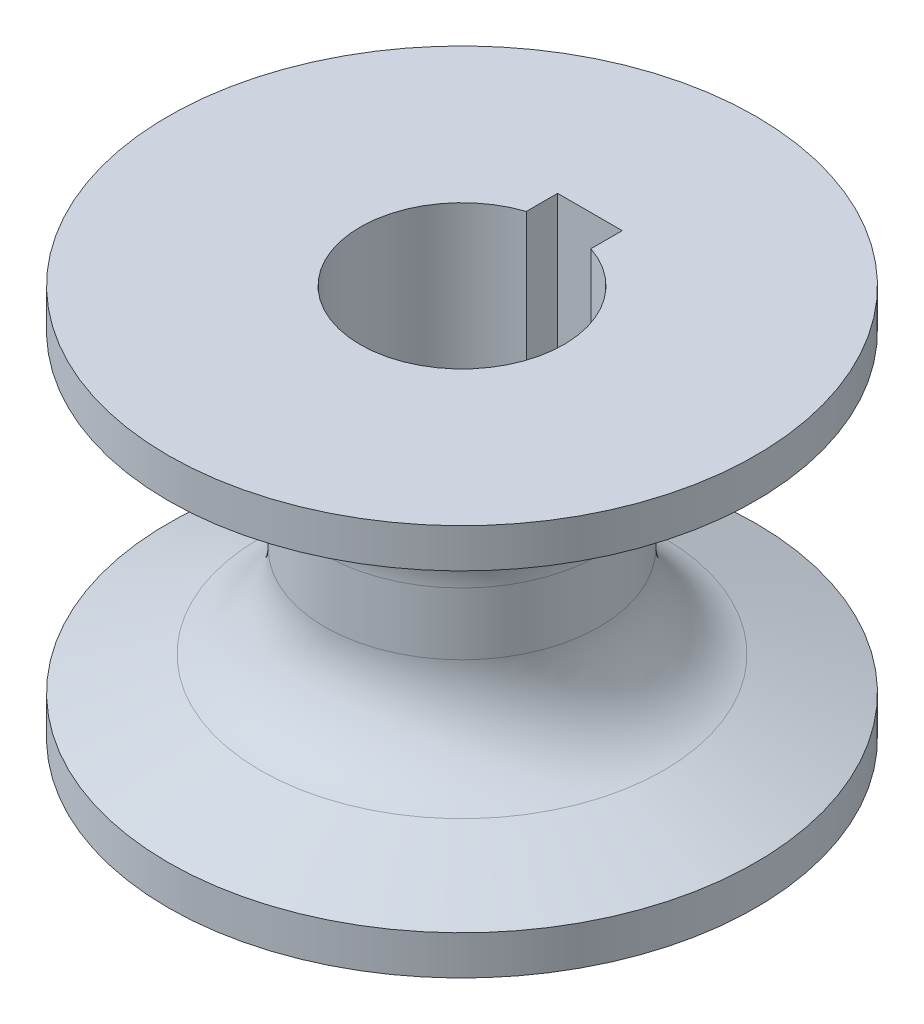
from build123d import *

# Parameters (mm, degrees)
ESBO_O2_R                = 15
RESSALTO_EXTRUS_O1_DEPTH = 20
FUROS_GUIA_COM_10_0MM1_D = 10.4
CORTE_EXTRUS_O1_DEPTH    = 30.154759474
FILETE1_R                = 5


with BuildPart() as part:
    # Esboço2 → Ressalto-extrusão1 (new body)
    with BuildSketch(Plane(origin=(0, 0, 0), x_dir=(1, 0, 0), z_dir=(0, 1, 0))):
        with Locations(Location((0, 0, 0), (0, 0, 270))):
            Circle(ESBO_O2_R)
    extrude(amount=RESSALTO_EXTRUS_O1_DEPTH)

    # Furos-guia com Ø10.0mm1 (through all)
    with Locations(Plane(origin=(0, 20, 0), x_dir=(1, 0, 0), z_dir=(0, 1, 0))):
        with Locations((0, 0)):
            Hole(FUROS_GUIA_COM_10_0MM1_D / 2)

    # Esboço6 → Corte-extrusão1 (cut, through all)
    with BuildSketch(Plane(origin=(0, 20, 0), x_dir=(1, 0, 0), z_dir=(0, 1, 0))):
        with BuildLine():
            Line((-1.65, 4.931277725), (-1.65, 6.531277725))
            Line((-1.65, 6.531277725), (1.65, 6.531277725))
            Line((1.65, 6.531277725), (1.65, 4.931277725))
            ThreePointArc((1.65, 4.931277725), (0, 5.189536775), (-1.65, 4.931277725))
        make_face()
    extrude(amount=-CORTE_EXTRUS_O1_DEPTH, mode=Mode.SUBTRACT)

    # Esboço7 → Corte-Revolução1 (revolve, cut)
    with BuildSketch(Plane.XY, mode=Mode.PRIVATE) as corte_revolu_o1_sk:
        Polygon((-15, 18), (-15, 2), (-7, 4.911761874), (-7, 15.088238126), align=None)
    revolve(corte_revolu_o1_sk.sketch.rotate(Axis((0, 0, 0), (0, 1, 0)), 270), axis=Axis((0, 0, 0), (0, 1, 0)), mode=Mode.SUBTRACT)

    # Filete1
    filete1_edges = [part.edges().sort_by_distance(p)[0] for p in [
        (0, 15.088238126, 7),
        (0, 4.911761874, 7),
    ]]
    fillet(filete1_edges, radius=FILETE1_R)


solid = part.part
